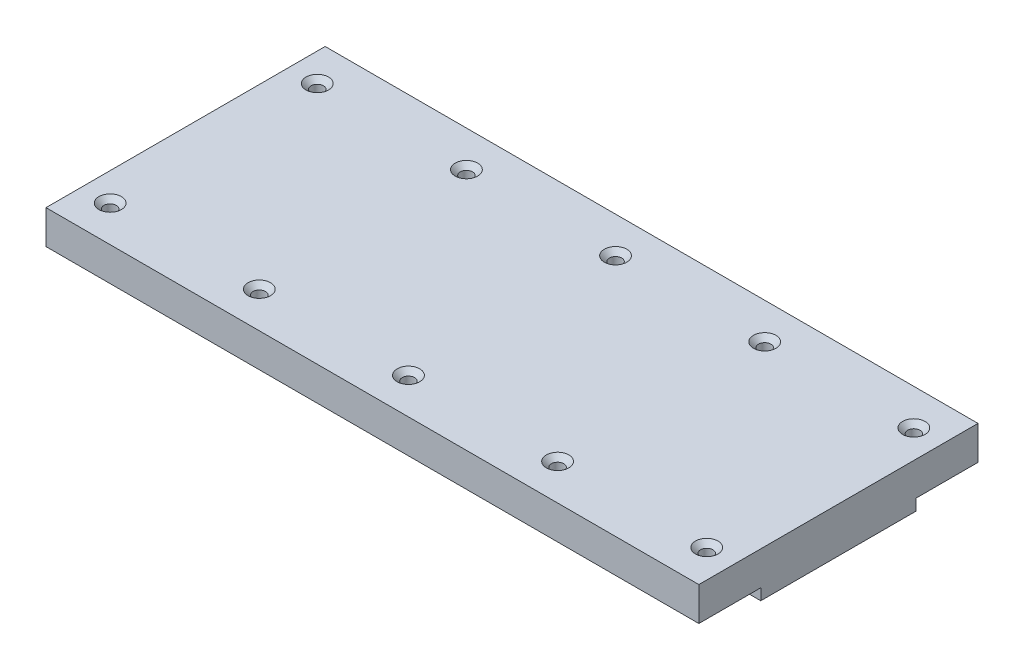
from build123d import *

# Parameters (mm, degrees)
BOSS_EXTRUDE1_DEPTH                              = 290
CSK_FOR_M10_FLAT_HEAD_MACHINE_SCREW1_D           = 11
CSK_FOR_M10_FLAT_HEAD_MACHINE_SCREW1_DEPTH       = 55.695266595
CSK_FOR_M10_FLAT_HEAD_MACHINE_SCREW1_CSINK_D     = 20
CSK_FOR_M10_FLAT_HEAD_MACHINE_SCREW1_CSINK_ANGLE = 90
CSK_FOR_M10_FLAT_HEAD_MACHINE_SCREW1_TIP         = 3.304733405


with BuildPart() as part:
    # Sketch2 → Boss-Extrude1 (new, symmetric)
    with BuildSketch(Plane(origin=(0, 0, 0), x_dir=(0, 0, -1), z_dir=(1, 0, 0))):
        Polygon((-124, 0), (124, 0), (124, -30), (69, -30), (69, -40), (-69, -40), (-69, -30), (-124, -30), align=None)
    extrude(amount=BOSS_EXTRUDE1_DEPTH, both=True)

    # CSK for M10 Flat Head Machine Screw1
    with Locations(Plane(origin=(-265, 0, -92), x_dir=(0, 0, 1), z_dir=(0, 1, 0))):
        with Locations((0, 0), (0, 132.5), (0, 265), (0, 397.5), (0, 530), (184, 530), (184, 397.5), (184, 265), (184, 132.5), (184, 0)):
            CounterSinkHole(CSK_FOR_M10_FLAT_HEAD_MACHINE_SCREW1_D / 2, CSK_FOR_M10_FLAT_HEAD_MACHINE_SCREW1_CSINK_D / 2, depth=CSK_FOR_M10_FLAT_HEAD_MACHINE_SCREW1_DEPTH, counter_sink_angle=CSK_FOR_M10_FLAT_HEAD_MACHINE_SCREW1_CSINK_ANGLE)
            with Locations((0, 0, -(CSK_FOR_M10_FLAT_HEAD_MACHINE_SCREW1_DEPTH + CSK_FOR_M10_FLAT_HEAD_MACHINE_SCREW1_TIP / 2))):  # 118° drill point
                Cone(0, CSK_FOR_M10_FLAT_HEAD_MACHINE_SCREW1_D / 2, CSK_FOR_M10_FLAT_HEAD_MACHINE_SCREW1_TIP, mode=Mode.SUBTRACT)


solid = part.part
